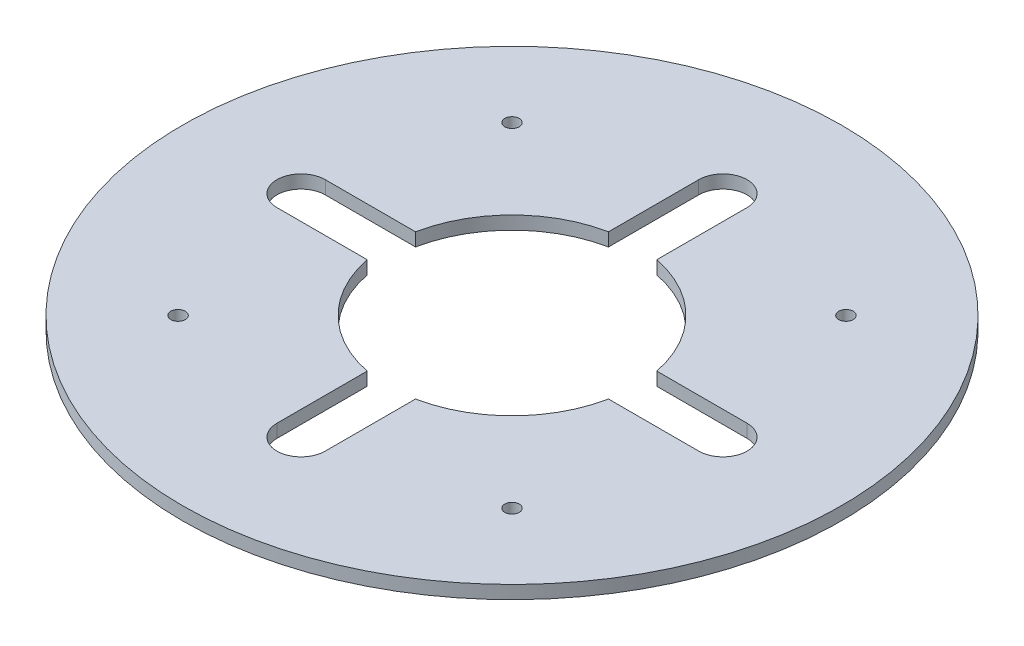
from build123d import *

# Parameters (mm, degrees)
SKETCH1_R                   = 75
SKETCH1_R_2                 = 28
BOSS_EXTRUDE1_DEPTH         = 3
CUT_EXTRUDE2_START          = -3
CUT_EXTRUDE2_DEPTH          = 3
CIRPATTERN1_COUNT           = 4
TAP_DRILL_FOR_M4X0_7_TAP1_D = 3.3
CIRPATTERN2_COUNT           = 4


with BuildPart() as part:
    # Sketch1 → Boss-Extrude1 (new body)
    with BuildSketch(Plane(origin=(0, 0, 0), x_dir=(1, 0, 0), z_dir=(0, 1, 0))):
        with Locations(Location((0, 0, 0), (0, 0, 270))):
            Circle(SKETCH1_R)
        with Locations(Location((0, 0, 0), (0, 0, 270))):
            Circle(SKETCH1_R_2, mode=Mode.SUBTRACT)
    extrude(amount=BOSS_EXTRUDE1_DEPTH)

    # Sketch2 → Cut-Extrude2 (cut)
    with BuildSketch(Plane(origin=(0, 3, 0), x_dir=(1, 0, 0), z_dir=(0, 1, 0)).offset(CUT_EXTRUDE2_START)):
        with BuildLine():
            Line((5.5, 27.454507827), (5.5, 48))
            ThreePointArc((5.5, 48), (0, 53.5), (-5.5, 48))
            Line((-5.5, 48), (-5.5, 27.454507827))
            ThreePointArc((-5.5, 27.454507827), (0, 28), (5.5, 27.454507827))
        make_face()
    cut_extrude2 = extrude(amount=CUT_EXTRUDE2_DEPTH, mode=Mode.SUBTRACT)

    # CirPattern1: Cut-Extrude2 ×4 about axis
    cirpattern1_axis = Axis((0, 0, 0), (0, 1, 0))
    for i in range(1, CIRPATTERN1_COUNT):
        add(cut_extrude2.rotate(cirpattern1_axis, i * 360 / CIRPATTERN1_COUNT), mode=Mode.SUBTRACT)

    # Tap Drill for M4x0.7 Tap1 (through all)
    with Locations(Plane(origin=(0, 3, 0), x_dir=(1, 0, 0), z_dir=(0, 1, 0))):
        with Locations((38, 38)):
            tap_drill_for_m4x0_7_tap1 = Hole(TAP_DRILL_FOR_M4X0_7_TAP1_D / 2)

    # CirPattern2: Tap Drill for M4x0.7 Tap1 ×4 about axis
    cirpattern2_axis = Axis((0, 0, 0), (0, 1, 0))
    for i in range(1, CIRPATTERN2_COUNT):
        add(tap_drill_for_m4x0_7_tap1.rotate(cirpattern2_axis, i * 360 / CIRPATTERN2_COUNT), mode=Mode.SUBTRACT)


solid = part.part
